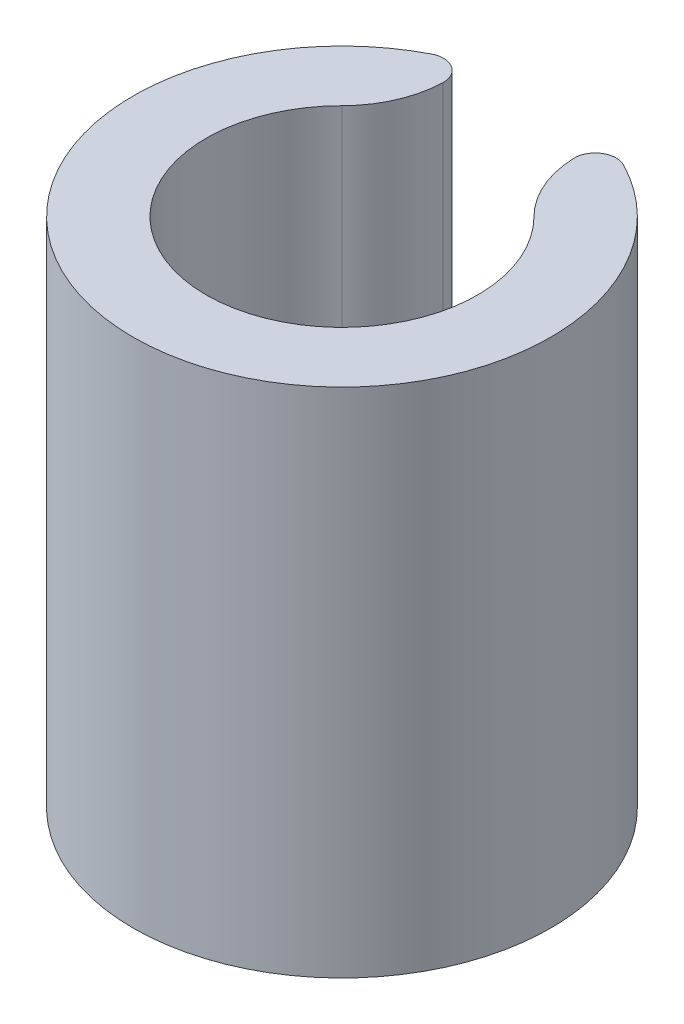
from build123d import *

# Parameters (mm, degrees)
SKETCH1_R           = 4
SKETCH1_R_2         = 2.6
BOSS_EXTRUDE1_DEPTH = 9.8
CUT_EXTRUDE1_DEPTH  = 12.315476128
FILLET1_R           = 0.4


with BuildPart() as part:
    # Sketch1 → Boss-Extrude1 (new body)
    with BuildSketch(Plane(origin=(0, 0, 0), x_dir=(1, 0, 0), z_dir=(0, 1, 0))):
        with Locations(Location((0, 0, 0), (0, 0, 270))):
            Circle(SKETCH1_R)
        with Locations(Location((0, 0, 0), (0, 0, 270))):
            Circle(SKETCH1_R_2, mode=Mode.SUBTRACT)
    extrude(amount=BOSS_EXTRUDE1_DEPTH)

    # Sketch2 → Cut-Extrude1 (cut, through all)
    with BuildSketch(Plane(origin=(0, 9.8, 0), x_dir=(1, 0, 0), z_dir=(0, 1, 0))):
        with BuildLine():
            ThreePointArc((-1.838477631, 1.838477631), (-1.320191838, 2.737476443), (-1.322144063, 3.775173516))
            ThreePointArc((-1.322144063, 3.775173516), (0, 4), (1.322144063, 3.775173516))
            ThreePointArc((1.322144063, 3.775173516), (1.320191838, 2.737476443), (1.838477631, 1.838477631))
            ThreePointArc((1.838477631, 1.838477631), (0, 2.6), (-1.838477631, 1.838477631))
        make_face()
    extrude(amount=-CUT_EXTRUDE1_DEPTH, mode=Mode.SUBTRACT)

    # Fillet1
    fillet1_edges = [part.edges().sort_by_distance(p)[0] for p in [
        (-1.322144063, 4.9, -3.775173516),
        (1.322144063, 4.9, -3.775173516),
    ]]
    fillet(fillet1_edges, radius=FILLET1_R)


solid = part.part
